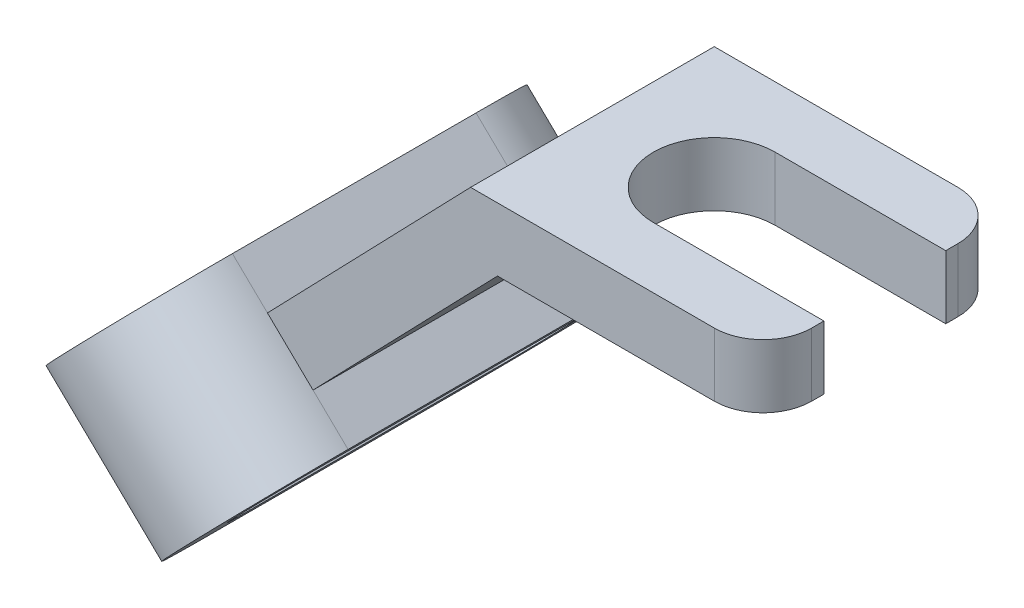
from build123d import *

# Parameters (mm, degrees)
BOSS_EXTRUDE1_DEPTH = 50
BOSS_EXTRUDE2_DEPTH = 16.5
CUT_EXTRUDE1_DEPTH  = 16.5
CUT_EXTRUDE2_REACH  = 141.217
FILLET1_R           = 10


with BuildPart() as part:
    # Sketch1 → Boss-Extrude1 (new body)
    with BuildSketch(Plane.XY):
        Polygon((54.481827389, 0), (0, 0), (-51.739424843, -53.577742843), (-61.090842247, -44.547184027), (-5.518172611, 13), (54.481827389, 13), align=None)
    extrude(amount=BOSS_EXTRUDE1_DEPTH)

    # Sketch4 → Boss-Extrude2 (add, symmetric)
    with BuildSketch(Plane(origin=(-4.675708702, 4.515279408, 0), x_dir=(0, 0, -1), z_dir=(0.7193398003386524, -0.6946583704589959, 0))):
        with BuildLine():
            Line((-50, -54.481827389), (0, -54.481827389))
            ThreePointArc((0, -54.481827389), (20, -74.481827389), (0, -94.481827389))
            Line((0, -94.481827389), (-50, -94.481827389))
            ThreePointArc((-50, -94.481827389), (-70, -74.481827389), (-50, -54.481827389))
        make_face()
        with BuildLine():
            Line((-50, -65.481827389), (0, -65.481827389))
            ThreePointArc((0, -65.481827389), (9, -74.481827389), (0, -83.481827389))
            Line((0, -83.481827389), (-50, -83.481827389))
            ThreePointArc((-50, -83.481827389), (-59, -74.481827389), (-50, -65.481827389))
        make_face(mode=Mode.SUBTRACT)
    extrude(amount=BOSS_EXTRUDE2_DEPTH, both=True)

    # Sketch4<2> → Cut-Extrude1 (cut, symmetric)
    with BuildSketch(Plane(origin=(-4.675708702, 4.515279408, 0), x_dir=(0, 0, -1), z_dir=(0.7193398003386524, -0.6946583704589959, 0))):
        with BuildLine():
            Line((0, -65.481827389), (-50, -65.481827389))
            ThreePointArc((-50, -65.481827389), (-59, -74.481827389), (-50, -83.481827389))
            Line((-50, -83.481827389), (0, -83.481827389))
            ThreePointArc((0, -83.481827389), (9, -74.481827389), (0, -65.481827389))
        make_face()
    extrude(amount=CUT_EXTRUDE1_DEPTH, both=True, mode=Mode.SUBTRACT)

    # Sketch6 → Cut-Extrude2 (cut, up to next)
    with BuildSketch(Plane(origin=(0, 13, 0), x_dir=(1, 0, 0), z_dir=(0, 1, 0)), mode=Mode.PRIVATE) as cut_extrude2_sk1:
        with BuildLine():
            Line((19.481827389, -12.5), (54.481827389, -12.5))
            ThreePointArc((54.481827389, -12.5), (66.981827389, -25), (54.481827389, -37.5))
            Line((54.481827389, -37.5), (19.481827389, -37.5))
            ThreePointArc((19.481827389, -37.5), (6.981827389, -25), (19.481827389, -12.5))
        make_face()
    cut_extrude2_tool1 = extrude(cut_extrude2_sk1.sketch, amount=-CUT_EXTRUDE2_REACH, mode=Mode.PRIVATE) & part.part
    add(cut_extrude2_tool1.solids().sort_by_distance((36.981827, 13, 25))[0], mode=Mode.SUBTRACT)

    # Fillet1
    fillet1_edges = [part.edges().sort_by_distance(p)[0] for p in [
        (54.481827389, 6.5, 0),
        (54.481827389, 6.5, 50),
    ]]
    fillet(fillet1_edges, radius=FILLET1_R)


solid = part.part
